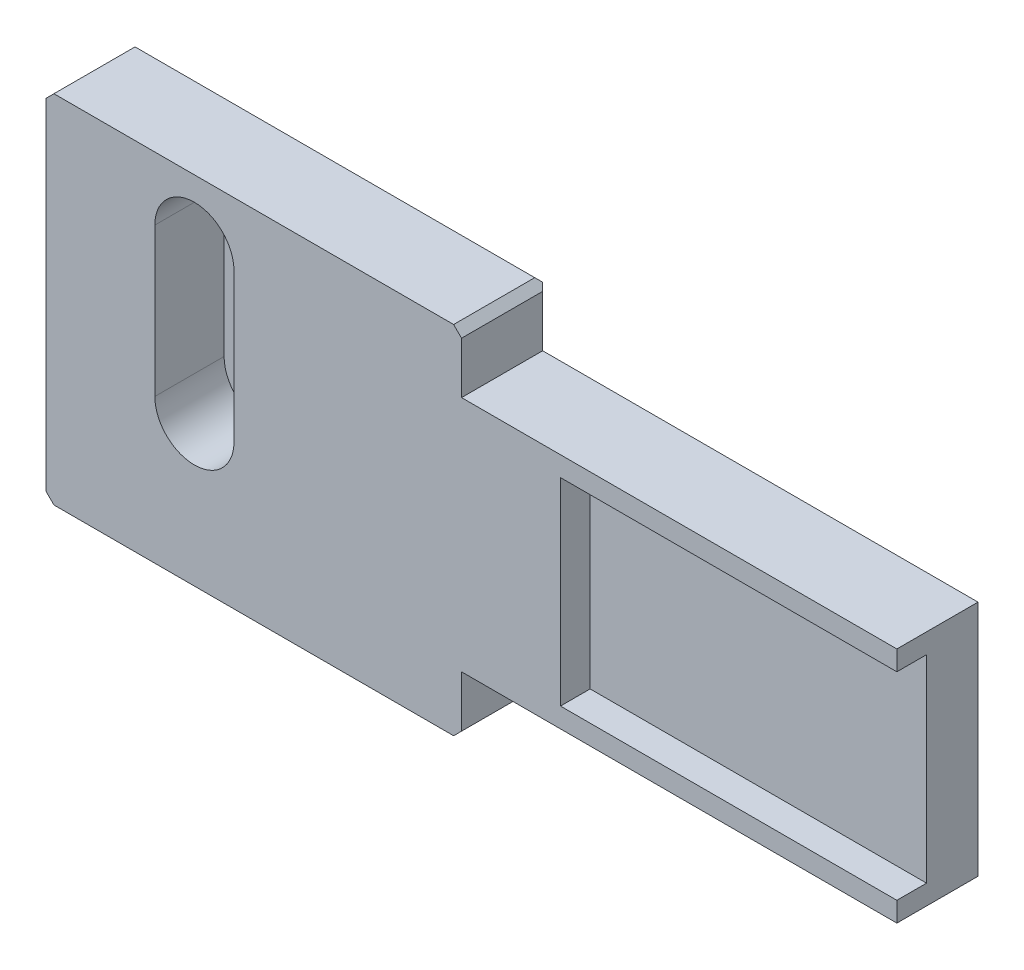
from build123d import *

# Parameters (mm, degrees)
SKETCH1_W           = 43
SKETCH1_H           = 18
BOSS_EXTRUDE1_DEPTH = 4.5
SKETCH2_W           = 22
SKETCH2_H           = 3
CUT_EXTRUDE1_DEPTH  = 47.832147079
SKETCH3_W           = 22
SKETCH3_H           = 3
CUT_EXTRUDE2_DEPTH  = 47.832147079
CUT_EXTRUDE3_DEPTH  = 3.5
CUT_EXTRUDE4_DEPTH  = 47.832147079
SKETCH6_W           = 1.5
SKETCH6_H           = 10
CUT_EXTRUDE5_DEPTH  = 17
CHAMFER1_SIZE       = 0.4
CHAMFER2_SIZE       = 0.4


with BuildPart() as part:
    # Sketch1 → Boss-Extrude1 (new body)
    with BuildSketch(Plane(origin=(0, 0, 0), x_dir=(-1, 0, 0), z_dir=(0, 0, -1))):
        with Locations((-21.5, 9)):
            Rectangle(SKETCH1_W, SKETCH1_H)
    extrude(amount=-BOSS_EXTRUDE1_DEPTH)

    # Sketch2 → Cut-Extrude1 (cut, through all)
    with BuildSketch(Plane.XY.offset(4.5)):
        with Locations((32, 1.5)):
            Rectangle(SKETCH2_W, SKETCH2_H)
    extrude(amount=-CUT_EXTRUDE1_DEPTH, mode=Mode.SUBTRACT)

    # Sketch3 → Cut-Extrude2 (cut, through all)
    with BuildSketch(Plane.XY.offset(4.5)):
        with Locations((32, 16.5)):
            Rectangle(SKETCH3_W, SKETCH3_H)
    extrude(amount=-CUT_EXTRUDE2_DEPTH, mode=Mode.SUBTRACT)

    # Sketch4 → Cut-Extrude3 (cut)
    with BuildSketch(Plane.XY.offset(4.5)):
        with BuildLine():
            Line((9.5, 14.8), (9.5, 7.3))
            ThreePointArc((9.5, 7.3), (7.5, 5.3), (5.5, 7.3))
            Line((5.5, 7.3), (5.5, 14.8))
            ThreePointArc((5.5, 14.8), (7.5, 16.8), (9.5, 14.8))
        make_face()
    extrude(amount=-CUT_EXTRUDE3_DEPTH, mode=Mode.SUBTRACT)

    # Sketch5 → Cut-Extrude4 (cut, through all)
    with BuildSketch(Plane(origin=(0, 0, 0), x_dir=(-1, 0, 0), z_dir=(0, 0, -1))):
        with BuildLine():
            Line((-6.300000004, 14.79990089), (-6.300621502, 7.27497794))
            ThreePointArc((-6.300621502, 7.27497794), (-7.500720608, 6.075077054), (-8.700621494, 7.27517616))
            Line((-8.700621494, 7.27517616), (-8.699999996, 14.80009911))
            ThreePointArc((-8.699999996, 14.80009911), (-7.49990089, 15.999999996), (-6.300000004, 14.79990089))
        make_face()
    extrude(amount=-CUT_EXTRUDE4_DEPTH, mode=Mode.SUBTRACT)

    # Sketch6 → Cut-Extrude5 (cut)
    with BuildSketch(Plane(origin=(43, 0, 0), x_dir=(0, 0, -1), z_dir=(1, 0, 0))):
        with Locations((-3.75, 9)):
            Rectangle(SKETCH6_W, SKETCH6_H)
    extrude(amount=-CUT_EXTRUDE5_DEPTH, mode=Mode.SUBTRACT)

    # Chamfer1
    chamfer1_edges = [part.edges().sort_by_distance(p)[0] for p in [
        (10.5, 0, 0),
        (21, 1.5, 0),
        (32, 3, 0),
        (43, 9, 0),
        (21, 16.5, 0),
        (32, 15, 0),
        (0, 9, 0),
        (10.5, 18, 0),
        (7.49990089, 15.999999996, 0),
        (8.700310745, 11.037637635, 0),
        (7.500720608, 6.075077054, 0),
        (6.300310753, 11.037439415, 0),
    ]]
    chamfer(chamfer1_edges, length=CHAMFER1_SIZE)

    # Chamfer2
    chamfer2_edges = [part.edges().sort_by_distance(p)[0] for p in [
        (21, 18, 2.45),
        (21, 0, 2.45),
        (0, 18, 2.45),
        (0, 0, 2.45),
    ]]
    chamfer(chamfer2_edges, length=CHAMFER2_SIZE)


solid = part.part
